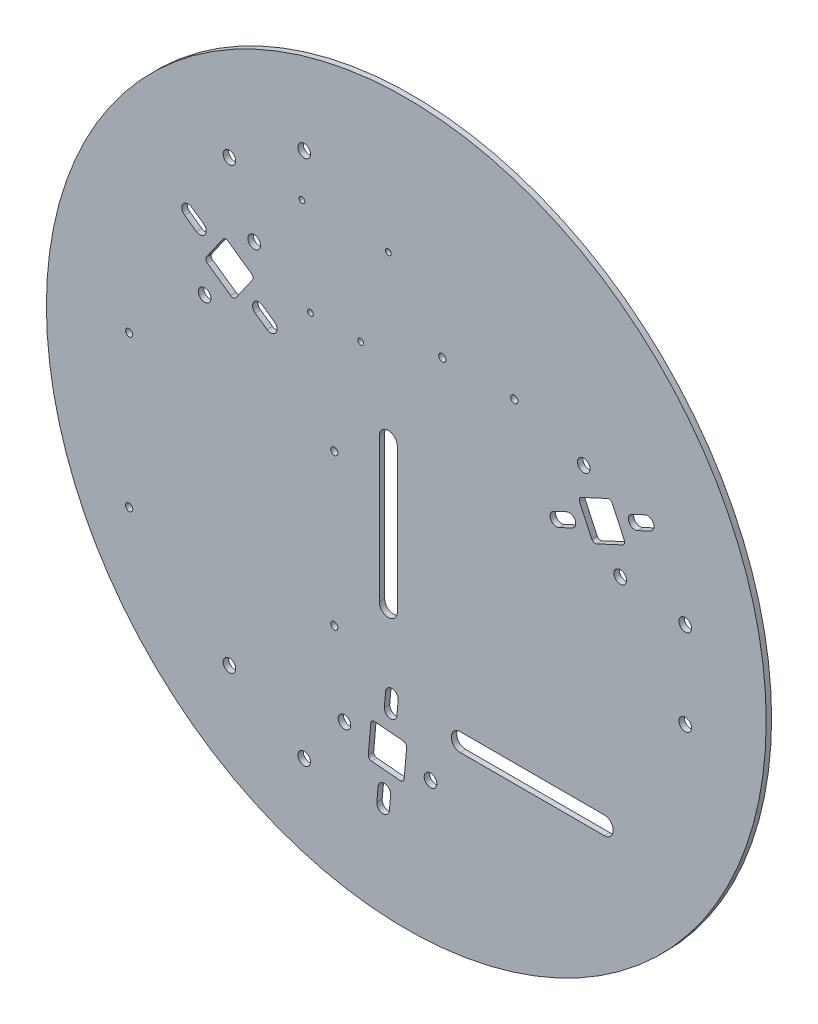
from build123d import *

# Parameters (mm, degrees)
SKETCH1_R           = 200
BOSS_EXTRUDE2_DEPTH = 3
SKETCH9_R           = 3.5
CUT_EXTRUDE8_DEPTH  = 3
CIRPATTERN5_COUNT   = 3
SKETCH15_R          = 2
CUT_EXTRUDE13_DEPTH = 3
SKETCH17_R          = 3.5
CUT_EXTRUDE15_DEPTH = 3
CIRPATTERN7_COUNT   = 3
CUT_EXTRUDE16_DEPTH = 3
CUT_EXTRUDE17_DEPTH = 3
SKETCH20_R          = 1.6
CUT_EXTRUDE18_DEPTH = 3
FILLET1_R           = 2
SKETCH21_R          = 2
CUT_EXTRUDE19_DEPTH = 3


with BuildPart() as part:
    # Sketch1 → Boss-Extrude2 (new body)
    with BuildSketch(Plane.XY):
        Circle(SKETCH1_R)
    extrude(amount=BOSS_EXTRUDE2_DEPTH)

    # Sketch9 → Cut-Extrude8 (cut)
    with BuildSketch(Plane.XY.offset(3)):
        with Locations((-56.715390309, 146.233937587)):
            Circle(SKETCH9_R)
        with Locations((-98.284609691, 122.233937587)):
            Circle(SKETCH9_R)
    cut_extrude8 = extrude(amount=-CUT_EXTRUDE8_DEPTH, mode=Mode.SUBTRACT)

    # CirPattern5: Cut-Extrude8 ×3 about axis
    cirpattern5_axis = Axis((0, 0, 0), (0, 0, 1))
    for i in range(1, CIRPATTERN5_COUNT):
        add(cut_extrude8.rotate(cirpattern5_axis, i * 360 / CIRPATTERN5_COUNT), mode=Mode.SUBTRACT)

    # Sketch15 → Cut-Extrude13 (cut)
    with BuildSketch(Plane.XY.offset(3)):
        with Locations((20, 85)):
            Circle(SKETCH15_R)
        with Locations((60, 85)):
            Circle(SKETCH15_R)
    extrude(amount=-CUT_EXTRUDE13_DEPTH, mode=Mode.SUBTRACT)

    # Sketch17 → Cut-Extrude15 (cut)
    with BuildSketch(Plane.XY.offset(3)):
        with Locations((-84.532410842, 88.488821425)):
            Circle(SKETCH17_R)
        with Locations((-112.064079787, 49.169523299)):
            Circle(SKETCH17_R)
        with Locations((-56.715390309, 146.233937587)):
            Circle(SKETCH17_R)
        with Locations((-98.284609691, 122.233937587)):
            Circle(SKETCH17_R)
        Polygon((-112.225530121, 66.373416283), (-95.842489235, 54.901887556), (-84.370960508, 71.284928442), (-100.754001394, 82.756457169), align=None)
        with BuildLine():
            Line((-79.907686902, 60.22467579), (-73.354470547, 55.636064299))
            ThreePointArc((-73.354470547, 55.636064299), (-72.49495592, 50.761514617), (-77.369505602, 49.901999989))
            Line((-77.369505602, 49.901999989), (-83.922721956, 54.49061148))
            ThreePointArc((-83.922721956, 54.49061148), (-84.782236584, 59.365161162), (-79.907686902, 60.22467579))
        make_face()
        with BuildLine():
            Line((-112.673768673, 83.167733244), (-119.226985028, 87.756344735))
            ThreePointArc((-119.226985028, 87.756344735), (-124.10153471, 86.896830107), (-123.242020082, 82.022280425))
            Line((-123.242020082, 82.022280425), (-116.688803728, 77.433668934))
            ThreePointArc((-116.688803728, 77.433668934), (-111.814254045, 78.293183562), (-112.673768673, 83.167733244))
        make_face()
    cut_extrude15 = extrude(amount=-CUT_EXTRUDE15_DEPTH, mode=Mode.SUBTRACT)

    # CirPattern7: Cut-Extrude15 ×3 about axis
    cirpattern7_axis = Axis((0, 0, 0), (0, 0, 1))
    for i in range(1, CIRPATTERN7_COUNT):
        add(cut_extrude15.rotate(cirpattern7_axis, i * 360 / CIRPATTERN7_COUNT), mode=Mode.SUBTRACT)

    # Sketch18 → Cut-Extrude16 (cut)
    with BuildSketch(Plane.XY.offset(3)):
        with BuildLine():
            Line((-5, 30), (-5, -50))
            ThreePointArc((-5, -50), (-10, -55), (-15, -50))
            Line((-15, -50), (-15, 30))
            ThreePointArc((-15, 30), (-10, 35), (-5, 30))
        make_face()
    extrude(amount=-CUT_EXTRUDE16_DEPTH, mode=Mode.SUBTRACT)

    # Sketch19 → Cut-Extrude17 (cut)
    with BuildSketch(Plane.XY.offset(3)):
        with BuildLine():
            Line((30, -90), (110, -90))
            ThreePointArc((110, -90), (115, -95), (110, -100))
            Line((110, -100), (30, -100))
            ThreePointArc((30, -100), (25, -95), (30, -90))
        make_face()
    extrude(amount=-CUT_EXTRUDE17_DEPTH, mode=Mode.SUBTRACT)

    # Sketch20 → Cut-Extrude18 (cut)
    with BuildSketch(Plane.XY.offset(3)):
        with Locations((-57.987394178, 121.9)):
            Circle(SKETCH20_R)
        with Locations((-10, 120.8)):
            Circle(SKETCH20_R)
        with Locations((-53.287394178, 70)):
            Circle(SKETCH20_R)
        with Locations((-25.387394178, 70)):
            Circle(SKETCH20_R)
    extrude(amount=-CUT_EXTRUDE18_DEPTH, mode=Mode.SUBTRACT)

    # Fillet1
    fillet1_edges = [part.edges().sort_by_distance(p)[0] for p in [
        (-1.368299576, -130.376868179, 1.5),
        (-21.292193538, -128.633753324, 1.5),
        (-19.549078683, -108.709859363, 1.5),
        (0.374815279, -110.452974218, 1.5),
        (113.593829697, 64.003451897, 1.5),
        (122.046194932, 45.877296156, 1.5),
        (103.920039191, 37.424930921, 1.5),
        (95.467673957, 55.551086662, 1.5),
        (-112.225530121, 66.373416283, 1.5),
        (-100.754001394, 82.756457169, 1.5),
        (-84.370960508, 71.284928442, 1.5),
        (-95.842489235, 54.901887556, 1.5),
    ]]
    fillet(fillet1_edges, radius=FILLET1_R)

    # Sketch21 → Cut-Extrude19 (cut)
    with BuildSketch(Plane.XY.offset(3)):
        with Locations((-154, 10)):
            Circle(SKETCH21_R)
        with Locations((-40, 10)):
            Circle(SKETCH21_R)
        with Locations((-154, -74)):
            Circle(SKETCH21_R)
        with Locations((-40, -74)):
            Circle(SKETCH21_R)
    extrude(amount=-CUT_EXTRUDE19_DEPTH, mode=Mode.SUBTRACT)


solid = part.part
